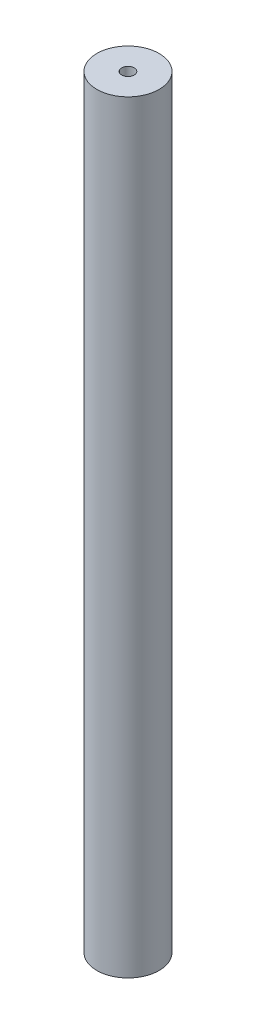
from build123d import *

# Parameters (mm, degrees)
SKETCH1_R                             = 12.7
BOSS_EXTRUDE1_DEPTH                   = 155.575
F_1_4_20_TAPPED_HOLE1_D               = 5.1054
F_1_4_20_TAPPED_HOLE1_DEPTH           = 16.51
F_1_4_20_TAPPED_HOLE1_TIP             = 1.533816902
F_1_4_20_TAPPED_HOLE1_ON_FACE_2_D     = 5.1054
F_1_4_20_TAPPED_HOLE1_ON_FACE_2_DEPTH = 16.51
F_1_4_20_TAPPED_HOLE1_ON_FACE_2_TIP   = 1.533816902


with BuildPart() as part:
    # Sketch1 → Boss-Extrude1 (new, symmetric)
    with BuildSketch(Plane(origin=(0, 0, 0), x_dir=(1, 0, 0), z_dir=(0, 1, 0))):
        with Locations(Location((0, 0, 0), (0, 0, 270))):
            Circle(SKETCH1_R)
    extrude(amount=BOSS_EXTRUDE1_DEPTH, both=True)

    # 1/4-20 Tapped Hole1
    with Locations(Plane.ZX.offset(155.575)):
        with Locations((0, 0)):
            Hole(F_1_4_20_TAPPED_HOLE1_D / 2, depth=F_1_4_20_TAPPED_HOLE1_DEPTH)
            with Locations((0, 0, -(F_1_4_20_TAPPED_HOLE1_DEPTH + F_1_4_20_TAPPED_HOLE1_TIP / 2))):  # 118° drill point
                Cone(0, F_1_4_20_TAPPED_HOLE1_D / 2, F_1_4_20_TAPPED_HOLE1_TIP, mode=Mode.SUBTRACT)

    # 1/4-20 Tapped Hole1 on face 2
    with Locations(Plane(origin=(0, -155.575, 0), x_dir=(0, 0, -1), z_dir=(0, -1, 0))):
        with Locations((0, 0)):
            Hole(F_1_4_20_TAPPED_HOLE1_ON_FACE_2_D / 2, depth=F_1_4_20_TAPPED_HOLE1_ON_FACE_2_DEPTH)
            with Locations((0, 0, -(F_1_4_20_TAPPED_HOLE1_ON_FACE_2_DEPTH + F_1_4_20_TAPPED_HOLE1_ON_FACE_2_TIP / 2))):  # 118° drill point
                Cone(0, F_1_4_20_TAPPED_HOLE1_ON_FACE_2_D / 2, F_1_4_20_TAPPED_HOLE1_ON_FACE_2_TIP, mode=Mode.SUBTRACT)


solid = part.part
